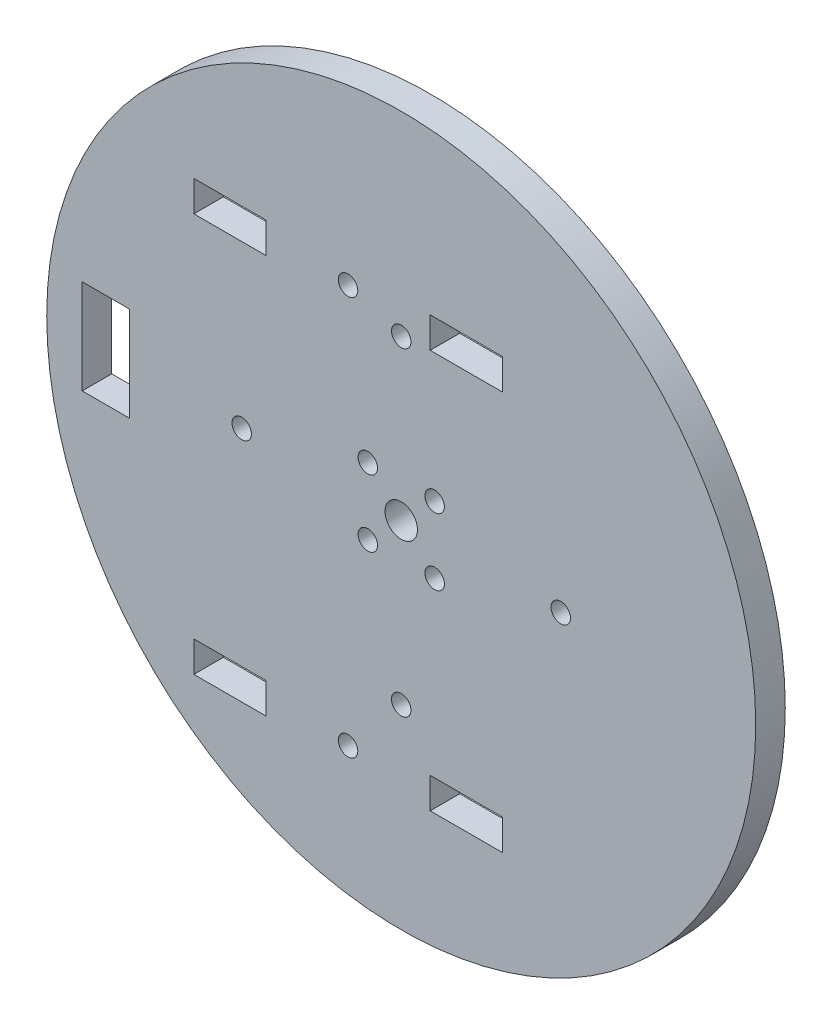
from build123d import *

# Parameters (mm, degrees)
ESKIZ_KONTUR_R        = 60
ESKIZ_KONTUR_W        = 12.2
ESKIZ_KONTUR_H        = 5.2
ESKIZ_KONTUR_W_2      = 8
ESKIZ_KONTUR_H_2      = 16
PLASTINA_DEPTH        = 5
OTVERSTIYA_DEPTH      = 86
OTVERSTIYA_DEPTH_BACK = 86
ESKIZ_OTVERSTIYA_R    = 1.65
ESKIZ_OTVERSTIYA_R_2  = 2.75


with BuildPart() as part:
    # Eskiz_kontur → Plastina (new body)
    with BuildSketch(Plane.XY):
        Circle(ESKIZ_KONTUR_R)
        with Locations((-29, -37.5)):
            Rectangle(ESKIZ_KONTUR_W, ESKIZ_KONTUR_H, mode=Mode.SUBTRACT)
        with Locations((11, -37.5)):
            Rectangle(ESKIZ_KONTUR_W, ESKIZ_KONTUR_H, mode=Mode.SUBTRACT)
        with Locations((-50, 0)):
            Rectangle(ESKIZ_KONTUR_W_2, ESKIZ_KONTUR_H_2, mode=Mode.SUBTRACT)
        with Locations((-29, 30)):
            Rectangle(ESKIZ_KONTUR_W, ESKIZ_KONTUR_H, mode=Mode.SUBTRACT)
        with Locations((11, 30)):
            Rectangle(ESKIZ_KONTUR_W, ESKIZ_KONTUR_H, mode=Mode.SUBTRACT)
    extrude(amount=PLASTINA_DEPTH)

    # Eskiz_otverstiya → Otverstiya (cut, two sides: drawn at the far end of the back side and taken through both)
    with BuildSketch(Plane.XY.offset(-OTVERSTIYA_DEPTH_BACK)):
        with Locations((-9, -37.5)):
            Circle(ESKIZ_OTVERSTIYA_R)
        with Locations((0, -27)):
            Circle(ESKIZ_OTVERSTIYA_R)
        with Locations((-5.65685, -5.65685)):
            Circle(ESKIZ_OTVERSTIYA_R)
        with Locations((5.65685, -5.65685)):
            Circle(ESKIZ_OTVERSTIYA_R)
        with Locations((-27, 0)):
            Circle(ESKIZ_OTVERSTIYA_R)
        Circle(ESKIZ_OTVERSTIYA_R_2)
        with Locations((-5.65685, 5.65685)):
            Circle(ESKIZ_OTVERSTIYA_R)
        with Locations((5.65685, 5.65685)):
            Circle(ESKIZ_OTVERSTIYA_R)
        with Locations((27, 0)):
            Circle(ESKIZ_OTVERSTIYA_R)
        with Locations((-9, 30)):
            Circle(ESKIZ_OTVERSTIYA_R)
        with Locations((0, 27)):
            Circle(ESKIZ_OTVERSTIYA_R)
    extrude(amount=OTVERSTIYA_DEPTH + OTVERSTIYA_DEPTH_BACK, mode=Mode.SUBTRACT)


solid = part.part
